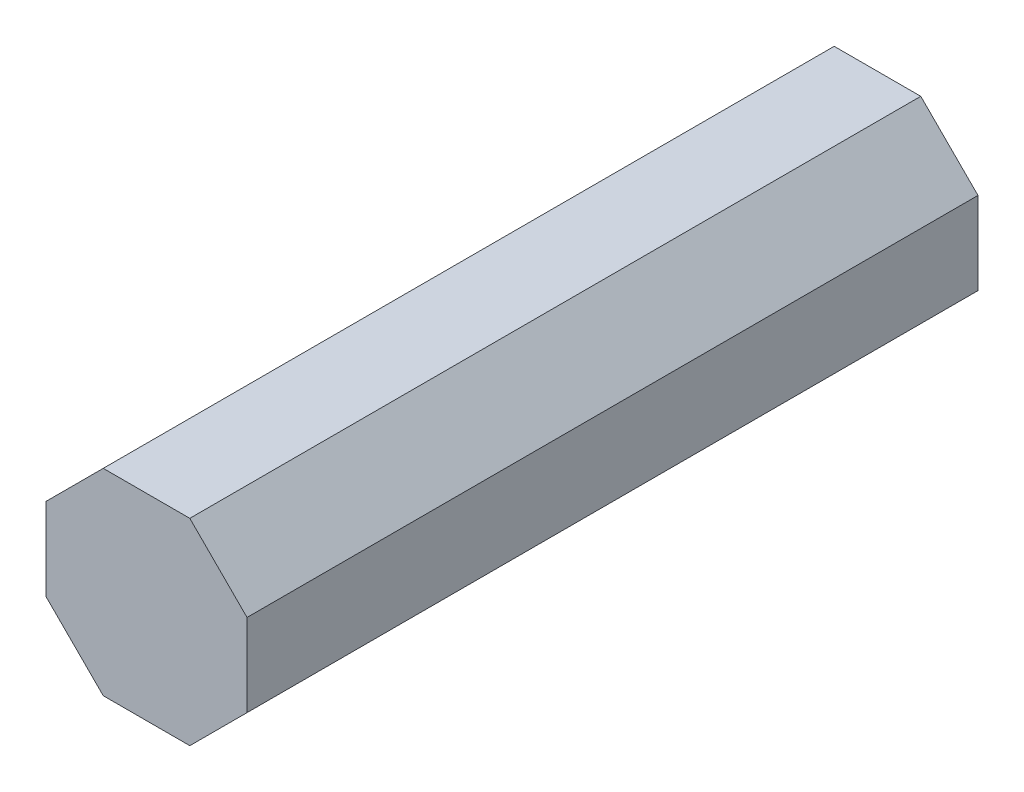
from build123d import *

# Parameters (mm, degrees)
EXTRUDE_1_DEPTH = 200


with BuildPart() as part:
    # 스케치1 → 보스-돌출1 (new body)
    with BuildSketch(Plane.XY):
        Polygon((-11.845241588, 27.121519912), (11.845241588, 27.121519912), (27.502126943, 11.464634557), (27.502126943, -11.096293459), (11.845241588, -26.753178814), (-11.845241588, -26.753178814), (-27.502126943, -11.096293459), (-27.502126943, 11.464634557), align=None)
    extrude(amount=EXTRUDE_1_DEPTH)


solid = part.part
